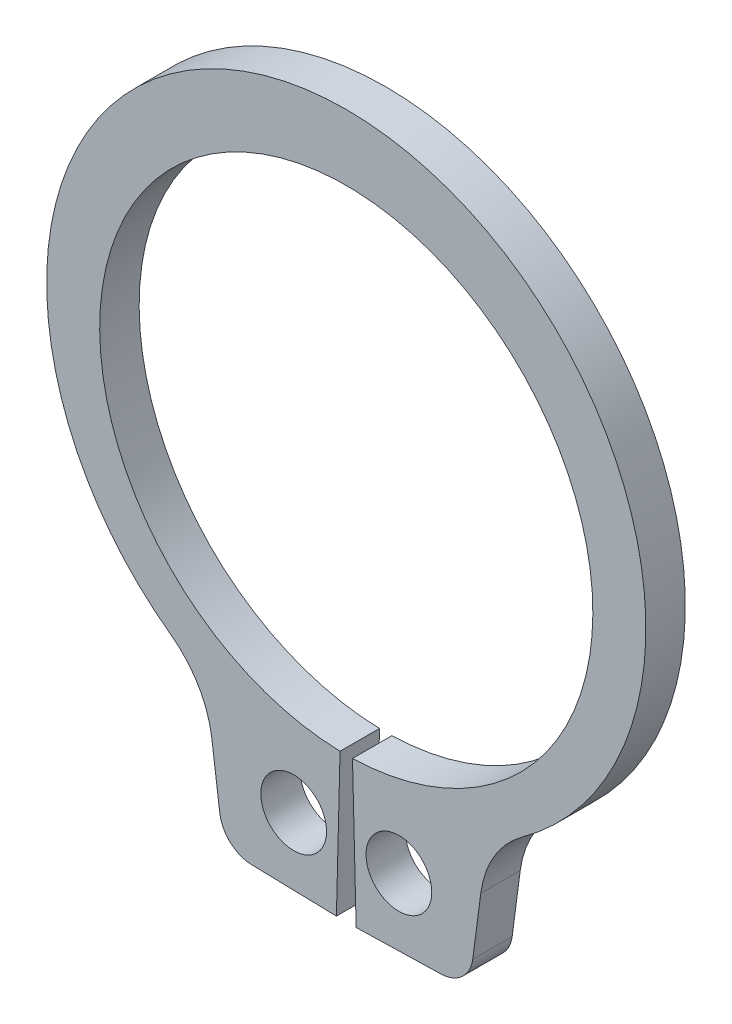
from build123d import *

# Parameters (mm, degrees)
BODYSKE_R  = 0.5
BODY_DEPTH = 0.6


with BuildPart() as part:
    # BodySke → Body (new body)
    with BuildSketch(Plane.XY):
        with BuildLine():
            Line((0.094537815, -3.748808157), (0.15, -5.948108943))
            Line((0.15, -5.948108943), (1.439764164, -5.915583543))
            ThreePointArc((1.439764164, -5.915583543), (1.761544697, -5.787476618), (1.922881553, -5.481005551))
            Line((1.922881553, -5.481005551), (2.045618819, -4.548723459))
            ThreePointArc((2.045618819, -4.548723459), (2.25078514, -3.957744017), (2.672900027, -3.496041794))
            ThreePointArc((2.672900027, -3.496041794), (0, 4.75), (-2.672900027, -3.496041794))
            ThreePointArc((-2.672900027, -3.496041794), (-2.25078514, -3.957744017), (-2.045618819, -4.548723459))
            Line((-2.045618819, -4.548723459), (-1.922881553, -5.481005551))
            ThreePointArc((-1.922881553, -5.481005551), (-1.761544697, -5.787476618), (-1.439764164, -5.915583543))
            Line((-1.439764164, -5.915583543), (-0.15, -5.948108943))
            Line((-0.15, -5.948108943), (-0.094537815, -3.748808157))
            ThreePointArc((-0.094537815, -3.748808157), (0, 3.75), (0.094537815, -3.748808157))
        make_face()
        with Locations((0.8, -4.910257122)):
            Circle(BODYSKE_R, mode=Mode.SUBTRACT)
        with Locations((-0.8, -4.910257122)):
            Circle(BODYSKE_R, mode=Mode.SUBTRACT)
    extrude(amount=-BODY_DEPTH)


solid = part.part
